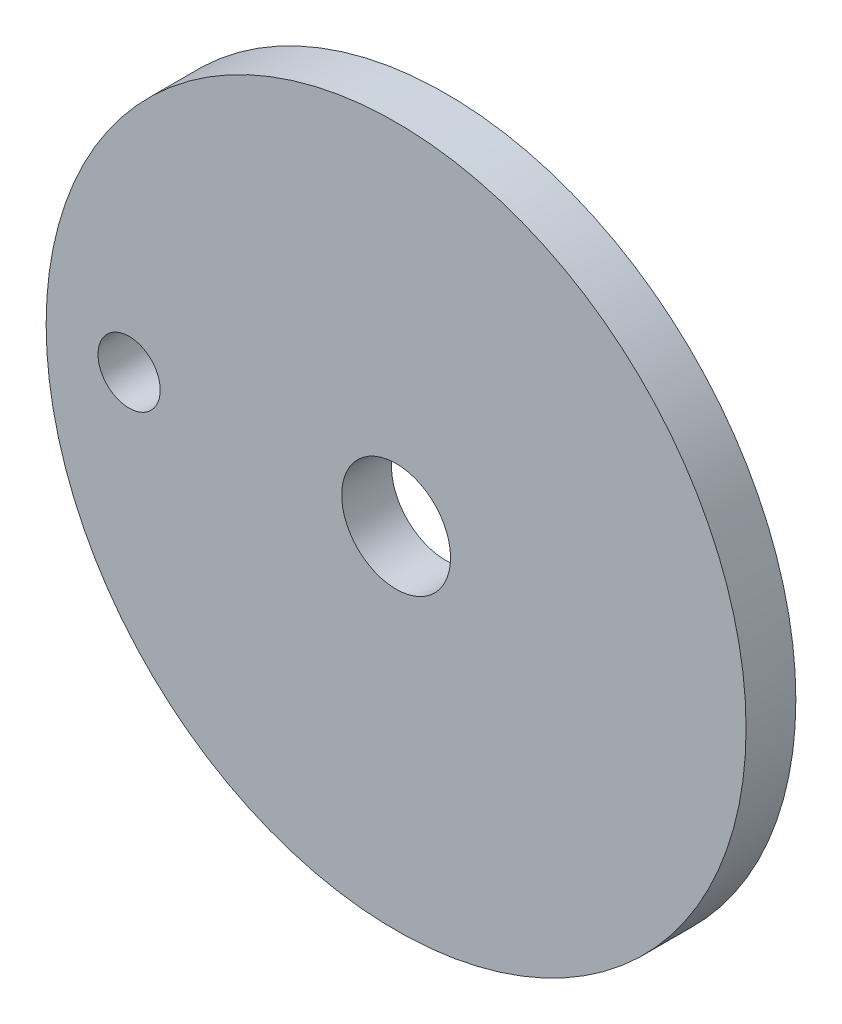
from build123d import *

# Parameters (mm, degrees)
SKETCH_2_R          = 22.5
SKETCH_2_R_2        = 3.5
EXTRUDE_2_DEPTH     = 3.2
SKETCH_4_R          = 2
CUT_EXTRUDE_1_DEPTH = 15


with BuildPart() as part:
    # Эскиз2 → Вытянуть2 (new body)
    with BuildSketch(Plane.XY):
        Circle(SKETCH_2_R)
        Circle(SKETCH_2_R_2, mode=Mode.SUBTRACT)
    extrude(amount=EXTRUDE_2_DEPTH)

    # Эскиз4 → Вырез-Вытянуть1 (cut)
    with BuildSketch(Plane.XY.offset(3.2)):
        with Locations((-17.165585922, 0)):
            Circle(SKETCH_4_R)
    extrude(amount=-CUT_EXTRUDE_1_DEPTH, mode=Mode.SUBTRACT)


solid = part.part
